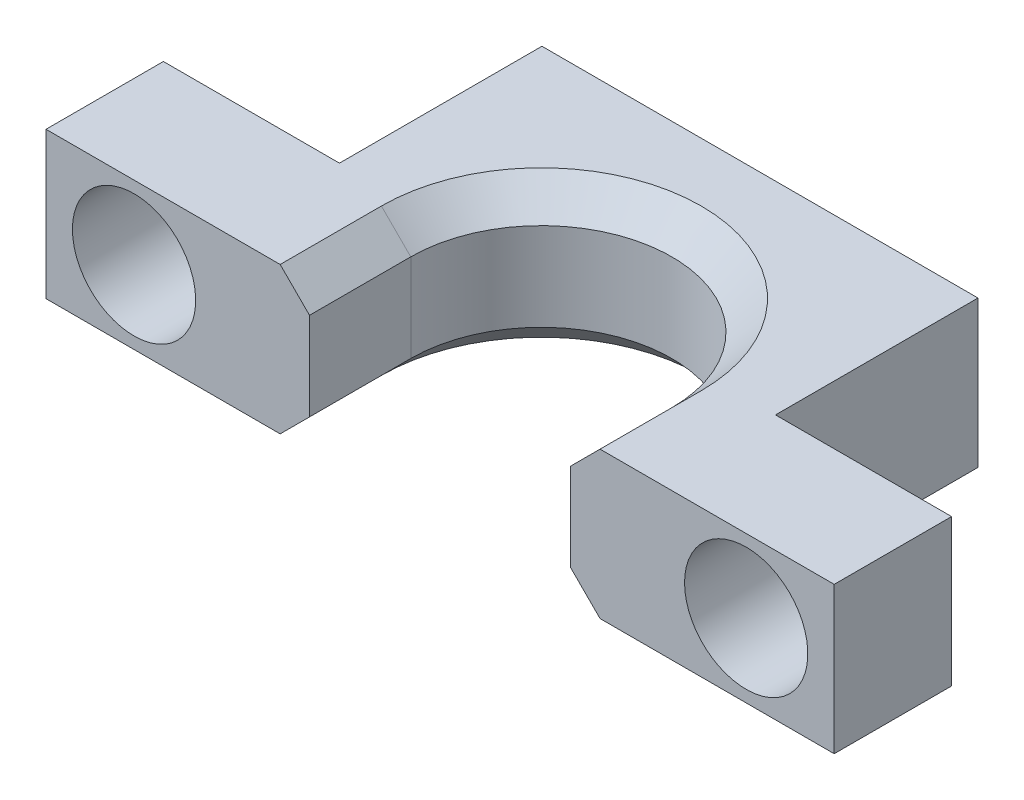
from build123d import *

# Parameters (mm, degrees)
SKETCH1_W               = 72.154028999
SKETCH1_H               = 39.439030188
BOSS_EXTRUDE1_DEPTH     = 2.5
CUT_EXTRUDE1_DEPTH      = 83.26719275
CUT_EXTRUDE1_DEPTH_BACK = 15
SKETCH2_W               = 72.154028999
SKETCH2_H               = 39.439030188
CHAMFER1_SIZE           = 0.5
CHAMFER2_SIZE           = 0.5
CUT_EXTRUDE2_DEPTH      = 10


with BuildPart() as part:
    # Sketch1 → Boss-Extrude1 (new body)
    with BuildSketch(Plane(origin=(0, 0, 0), x_dir=(1, 0, 0), z_dir=(0, 1, 0))):
        with Locations((36.0770145, 19.719515094)):
            Rectangle(SKETCH1_W, SKETCH1_H)
    extrude(amount=BOSS_EXTRUDE1_DEPTH)

    # Sketch2 → Cut-Extrude1 (cut, two sides: drawn at the far end of the back side and taken through both)
    with BuildSketch(Plane(origin=(0, 2.5, 0), x_dir=(1, 0, 0), z_dir=(0, 1, 0)).offset(-CUT_EXTRUDE1_DEPTH_BACK)):
        with Locations((36.0770145, 19.719515094)):
            Rectangle(SKETCH2_W, SKETCH2_H)
        with BuildLine():
            Line((38.3020145, 17.735642877), (38.3020145, 19.460642877))
            ThreePointArc((38.3020145, 19.460642877), (36.0770145, 21.685642877), (33.8520145, 19.460642877))
            Line((33.8520145, 19.460642877), (33.8520145, 17.735642877))
            Line((33.8520145, 17.735642877), (29.362179375, 17.735642877))
            Line((29.362179375, 17.735642877), (29.362179375, 19.735642877))
            Line((29.362179375, 19.735642877), (32.362179375, 19.735642877))
            Line((32.362179375, 19.735642877), (32.362179375, 23.185642877))
            Line((32.362179375, 23.185642877), (39.791849624, 23.185642877))
            Line((39.791849624, 23.185642877), (39.791849624, 19.735642877))
            Line((39.791849624, 19.735642877), (42.791849624, 19.735642877))
            Line((42.791849624, 19.735642877), (42.791849624, 17.735642877))
            Line((42.791849624, 17.735642877), (38.3020145, 17.735642877))
        make_face(mode=Mode.SUBTRACT)
    extrude(amount=CUT_EXTRUDE1_DEPTH + CUT_EXTRUDE1_DEPTH_BACK, mode=Mode.SUBTRACT)

    # Chamfer1
    chamfer1_edges = [part.edges().sort_by_distance(p)[0] for p in [
        (36.0770145, 0, -21.685642877),
        (33.8520145, 0, -18.598142877),
        (38.3020145, 0, -18.598142877),
    ]]
    chamfer(chamfer1_edges, length=CHAMFER1_SIZE)

    # Chamfer2
    chamfer2_edges = [part.edges().sort_by_distance(p)[0] for p in [
        (38.3020145, 2.5, -18.598142877),
        (33.8520145, 2.5, -18.598142877),
        (36.0770145, 2.5, -21.685642877),
    ]]
    chamfer(chamfer2_edges, length=CHAMFER2_SIZE)

    # Sketch4 → Cut-Extrude2 (cut)
    with BuildSketch(Plane(origin=(0, 0, -19.735642877), x_dir=(-1, 0, 0), z_dir=(0, 0, -1))):
        with BuildLine():
            ThreePointArc((-42.341849624, 1.25), (-41.291849624, 0.2), (-40.241849624, 1.25))
            Line((-40.241849624, 1.25), (-42.341849624, 1.25))
        make_face()
        with BuildLine():
            Line((-42.341849624, 1.25), (-40.241849624, 1.25))
            ThreePointArc((-40.241849624, 1.25), (-41.291849624, 2.3), (-42.341849624, 1.25))
        make_face()
        with BuildLine():
            ThreePointArc((-29.812179375, 1.25), (-30.862179375, 2.3), (-31.912179375, 1.25))
            Line((-31.912179375, 1.25), (-29.812179375, 1.25))
        make_face()
        with BuildLine():
            Line((-29.812179375, 1.25), (-31.912179375, 1.25))
            ThreePointArc((-31.912179375, 1.25), (-30.862179375, 0.2), (-29.812179375, 1.25))
        make_face()
    extrude(amount=-CUT_EXTRUDE2_DEPTH, mode=Mode.SUBTRACT)


solid = part.part
